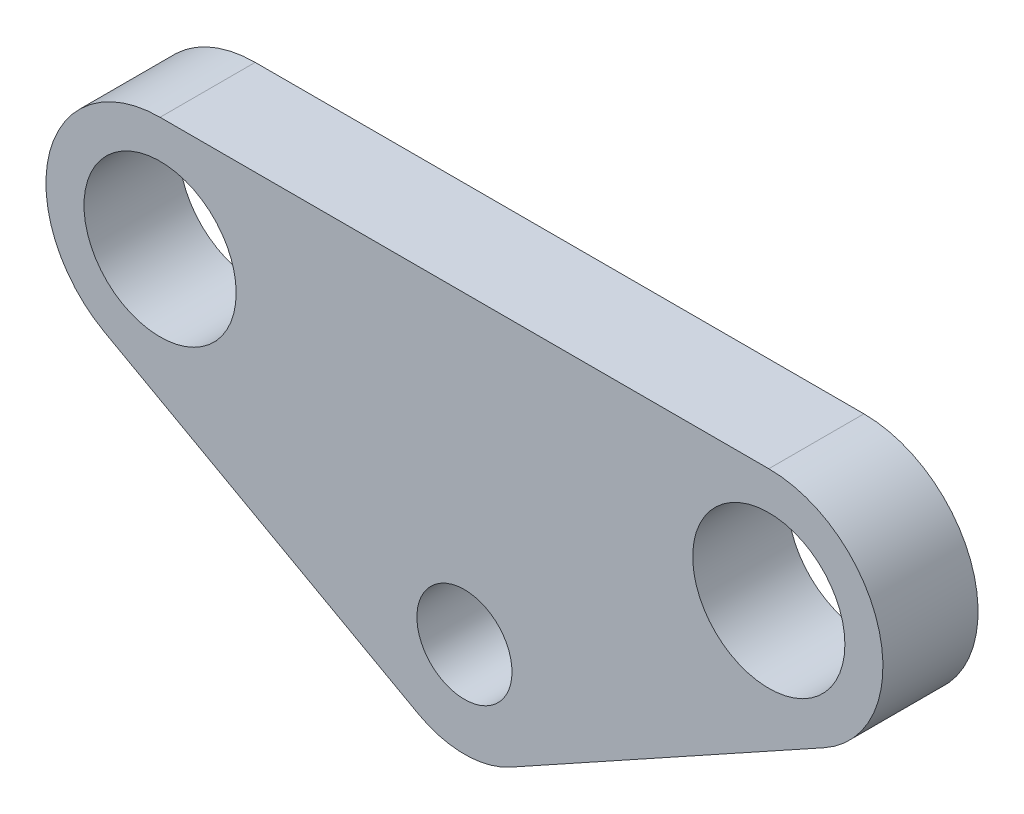
from build123d import *

# Parameters (mm, degrees)
SKETCH1_R           = 2.5
SKETCH1_R_2         = 4
BOSS_EXTRUDE1_DEPTH = 5


with BuildPart() as part:
    # Sketch1 → Boss-Extrude1 (new body)
    with BuildSketch(Plane.XY):
        with BuildLine():
            Line((16, 16), (-16, 16))
            ThreePointArc((-16, 16), (-21.809314436, 11.5006218), (-18.905861295, 4.750621929))
            Line((-18.905861295, 4.750621929), (-2.421551079, -4.374481726))
            ThreePointArc((-2.421551079, -4.374481726), (0, -5), (2.421551079, -4.374481726))
            Line((2.421551079, -4.374481726), (18.905861295, 4.750621929))
            ThreePointArc((18.905861295, 4.750621929), (21.809314436, 11.5006218), (16, 16))
        make_face()
        Circle(SKETCH1_R, mode=Mode.SUBTRACT)
        with Locations((-16, 10)):
            Circle(SKETCH1_R_2, mode=Mode.SUBTRACT)
        with Locations((16, 10)):
            Circle(SKETCH1_R_2, mode=Mode.SUBTRACT)
    extrude(amount=BOSS_EXTRUDE1_DEPTH)


solid = part.part
